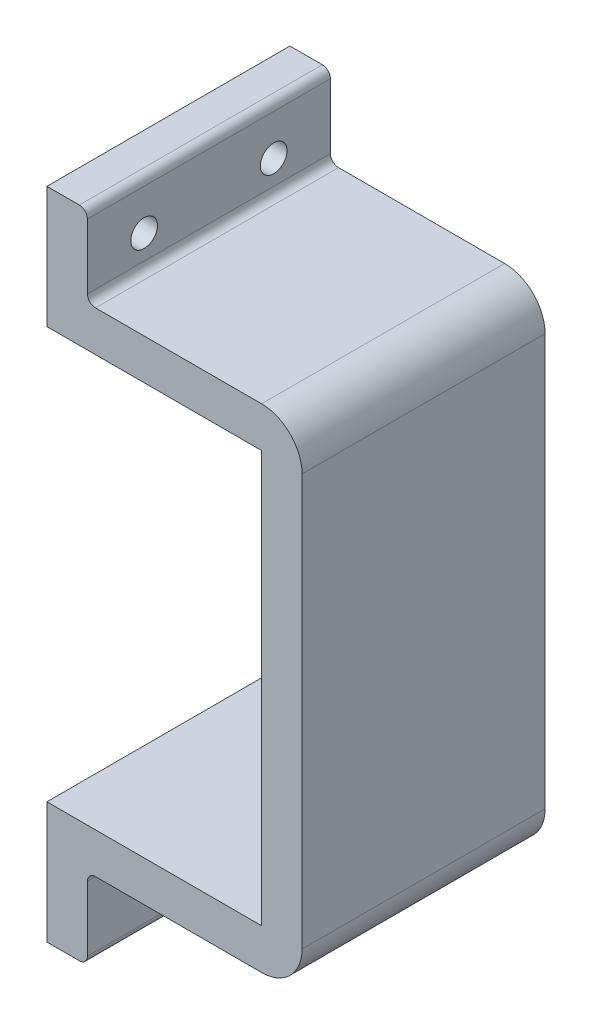
from build123d import *

# Parameters (mm, degrees)
BOSS_EXTRUDE1_DEPTH = 30
SKETCH2_R           = 1.65
CUT_EXTRUDE2_DEPTH  = 30
FILLET1_R           = 5
FILLET2_R           = 1


with BuildPart() as part:
    # Sketch1 → Boss-Extrude1 (new body)
    with BuildSketch(Plane.XY):
        Polygon((-13.25, -40.4), (-13.25, -25.4), (13.25, -25.4), (13.25, 25.4), (-13.25, 25.4), (-13.25, 40.4), (-8.25, 40.4), (-8.25, 30.4), (18.25, 30.4), (18.25, -30.4), (-8.25, -30.4), (-8.25, -40.4), align=None)
    extrude(amount=BOSS_EXTRUDE1_DEPTH)

    # Sketch2 → Cut-Extrude2 (cut)
    with BuildSketch(Plane.ZY.offset(13.25)):
        with Locations((7, 34.4)):
            Circle(SKETCH2_R)
        with Locations((23, 34.4)):
            Circle(SKETCH2_R)
        with Locations((7, -34.4)):
            Circle(SKETCH2_R)
        with Locations((23, -34.4)):
            Circle(SKETCH2_R)
    extrude(amount=-CUT_EXTRUDE2_DEPTH, mode=Mode.SUBTRACT)

    # Fillet1
    fillet1_edges = [part.edges().sort_by_distance(p)[0] for p in [
        (18.25, 30.4, 15),
        (18.25, -30.4, 15),
    ]]
    fillet(fillet1_edges, radius=FILLET1_R)

    # Fillet2
    fillet2_edges = [part.edges().sort_by_distance(p)[0] for p in [
        (-8.25, 40.4, 15),
        (-8.25, 30.4, 15),
        (-8.25, -30.4, 15),
        (-8.25, -40.4, 15),
    ]]
    fillet(fillet2_edges, radius=FILLET2_R)


solid = part.part
